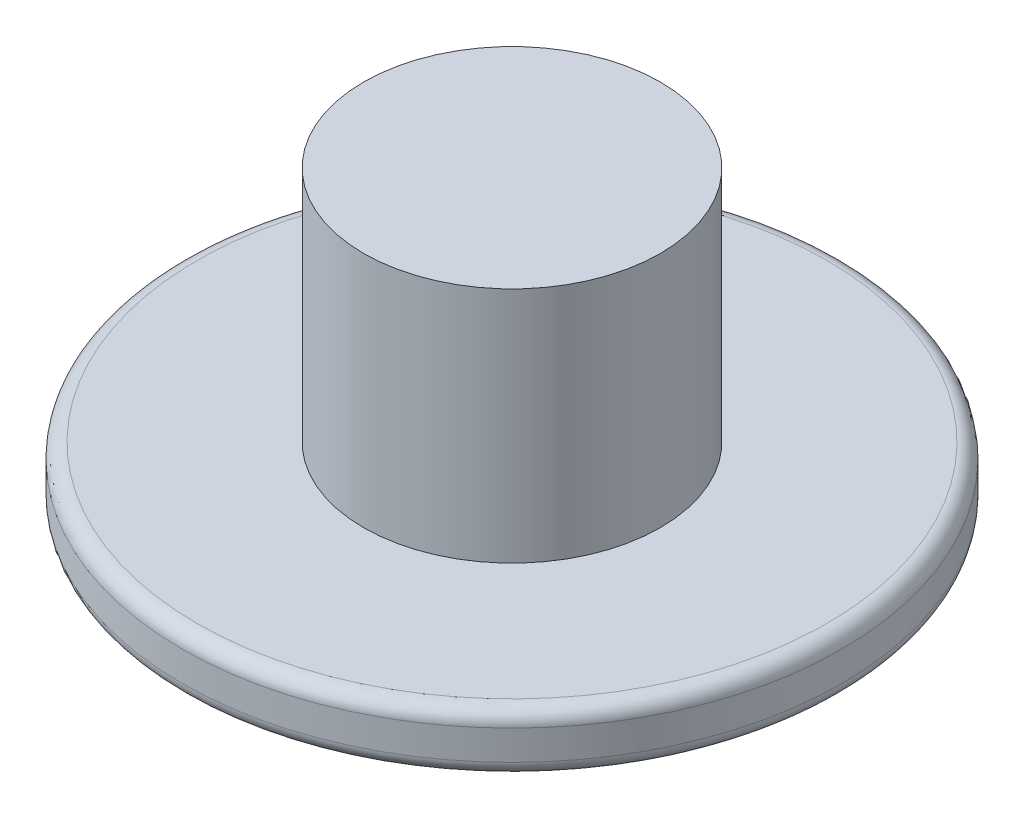
from build123d import *

# Parameters (mm, degrees)
SKETCH1_R           = 11.1
BOSS_EXTRUDE5_DEPTH = 2
SKETCH4_R           = 5
BOSS_EXTRUDE6_DEPTH = 8
CUT_EXTRUDE2_DEPTH  = 0.5
FILLET1_R           = 0.5


with BuildPart() as part:
    # Sketch1 → Boss-Extrude5 (new body)
    with BuildSketch(Plane(origin=(0, 0, 0), x_dir=(1, 0, 0), z_dir=(0, 1, 0))):
        with Locations(Location((-5.408676197, -40.3067379, 0), (0, 0, 270))):
            Circle(SKETCH1_R)
    extrude(amount=BOSS_EXTRUDE5_DEPTH)

    # Sketch4 → Boss-Extrude6 (add)
    with BuildSketch(Plane(origin=(0, 2, 0), x_dir=(1, 0, 0), z_dir=(0, 1, 0))):
        with Locations(Location((-5.408676197, -40.3067379, 0), (0, 0, 270))):
            Circle(SKETCH4_R)
    extrude(amount=BOSS_EXTRUDE6_DEPTH)

    # Sketch5 → Cut-Extrude2 (cut)
    # profile 1 of 2: a face of its own
    with BuildSketch(Plane.XZ):
        with BuildLine():
            add(Edge.make_bspline(
                [(-9.348280875, 34.997857225), (-9.429333066, 34.998925916), (-9.589055323, 35.00103189), (-9.824692592, 35.018969249), (-10.052139059, 35.047110023), (-10.271335187, 35.088929086), (-10.483398362, 35.137209285), (-10.686131565, 35.201546946), (-10.880525189, 35.277405617), (-11.066655927, 35.363831554), (-11.246416013, 35.46076718), (-11.41652077, 35.570711045), (-11.580603029, 35.689859604), (-11.731988802, 35.825058841), (-11.879672284, 35.966553737), (-12.017145665, 36.122411024), (-12.145997671, 36.289810874), (-12.225095718, 36.408144712), (-12.264947542, 36.467764632)],
                knots=[0, 0, 0, 0, 1.136959265, 2.24050327, 3.313538964, 4.350357384, 5.370001804, 6.362877957, 7.331147751, 8.295754707, 9.240328319, 10.193734322, 11.135547026, 12.081756115, 13.038655239, 14.003557421, 14.994136006, 16, 16, 16, 16], degree=3))
            add(Edge.make_bspline(
                [(-12.264947542, 36.467764632), (-12.289942987, 36.509599058), (-12.337758837, 36.589627584), (-12.387888727, 36.715200928), (-12.421628744, 36.837638128), (-12.425225681, 36.91958893), (-12.426984579, 36.959662781)],
                knots=[0, 0, 0, 0, 1.112928258, 2.129012325, 3.085089127, 4, 4, 4, 4], degree=3))
            add(Edge.make_bspline(
                [(-12.426984579, 36.959662781), (-12.42386445, 37.018611418), (-12.417733767, 37.134438536), (-12.362442051, 37.299905999), (-12.276027178, 37.451975969), (-12.156375821, 37.584975855), (-12.015845512, 37.694688532), (-11.862877809, 37.778848381), (-11.698339271, 37.828938976), (-11.584977892, 37.834547593), (-11.528064826, 37.837363398)],
                knots=[0, 0, 0, 0, 1.015359854, 1.995062352, 2.979785778, 4.01807891, 5.06205617, 6.045714794, 7.018851354, 8, 8, 8, 8], degree=3))
            add(Edge.make_bspline(
                [(-11.528064826, 37.837363398), (-11.469724299, 37.83435616), (-11.354883604, 37.828436549), (-11.190613761, 37.771014425), (-11.040274475, 37.678797497), (-10.957333486, 37.593729857), (-10.9146389, 37.549940558)],
                knots=[0, 0, 0, 0, 0.99888911, 1.966268167, 2.953119069, 4, 4, 4, 4], degree=3))
            add(Edge.make_bspline(
                [(-10.9146389, 37.549940558), (-10.879886734, 37.510744606), (-10.814314669, 37.436787791), (-10.722620774, 37.332452329), (-10.641410463, 37.245050369), (-10.575336051, 37.170386468), (-10.521334251, 37.110571578), (-10.479440485, 37.065014272), (-10.450829972, 37.033824854), (-10.435629616, 37.018791208), (-10.430456801, 37.013675126)],
                knots=[0, 0, 0, 0, 1.739958547, 3.283037843, 4.613396854, 5.70242641, 6.594602764, 7.289956713, 7.758366037, 8, 8, 8, 8], degree=3))
            add(Edge.make_bspline(
                [(-10.430456801, 37.013675126), (-10.36313084, 36.969076812), (-10.223989573, 36.876906333), (-9.976334602, 36.78875878), (-9.695380015, 36.734202734), (-9.495824901, 36.728995132), (-9.390719147, 36.726252287)],
                knots=[0, 0, 0, 0, 0.880598761, 1.819916513, 2.851749203, 4, 4, 4, 4], degree=3))
            add(Edge.make_bspline(
                [(-9.390719147, 36.726252287), (-9.310196622, 36.728306183), (-9.152233822, 36.732335356), (-8.920476184, 36.769202199), (-8.698236007, 36.823768439), (-8.486493219, 36.903396451), (-8.285798841, 37.007269388), (-8.095200026, 37.132741273), (-7.91343265, 37.280115557), (-7.804542441, 37.393739296), (-7.74912964, 37.451560929)],
                knots=[0, 0, 0, 0, 1.043544114, 2.047143341, 3.036120758, 4.007218486, 4.973146945, 5.960717165, 6.962235672, 8, 8, 8, 8], degree=3))
            add(Edge.make_bspline(
                [(-7.74912964, 37.451560929), (-7.698290904, 37.510330921), (-7.597702696, 37.626611708), (-7.471302174, 37.817509614), (-7.361845015, 38.01513562), (-7.272902713, 38.222638341), (-7.203360707, 38.43968009), (-7.152851188, 38.666184883), (-7.123862212, 38.902060553), (-7.120198073, 39.062208211), (-7.118342603, 39.143304756)],
                knots=[0, 0, 0, 0, 1.008012047, 1.994426572, 2.965889163, 3.938248186, 4.920413956, 5.921034844, 6.947240987, 8, 8, 8, 8], degree=3))
            add(Edge.make_bspline(
                [(-7.118342603, 39.143304756), (-7.119787334, 39.220472046), (-7.122582689, 39.369780131), (-7.134532938, 39.586355176), (-7.161145421, 39.78755433), (-7.191575578, 39.97443922), (-7.236956686, 40.145696376), (-7.290724001, 40.302535454), (-7.353213551, 40.445376304), (-7.427705844, 40.572401071), (-7.510388514, 40.684923347), (-7.603549658, 40.783401173), (-7.709065861, 40.863369288), (-7.821271667, 40.933845528), (-7.947121271, 40.981758755), (-8.079991019, 41.022374136), (-8.224362585, 41.042361901), (-8.323288585, 41.045584005), (-8.37412964, 41.047239941)],
                knots=[0, 0, 0, 0, 1.432194387, 2.771099032, 4.021603008, 5.196571272, 6.281788198, 7.304329707, 8.271053509, 9.169388415, 10.030836102, 10.857799991, 11.674021384, 12.482268335, 13.306473372, 14.163613793, 15.05622575, 16, 16, 16, 16], degree=3))
            add(Edge.make_bspline(
                [(-8.37412964, 41.047239941), (-8.464905564, 41.045032724), (-8.64192559, 41.04072848), (-8.900708904, 41.006657661), (-9.146078932, 40.954168305), (-9.37814883, 40.875990149), (-9.595614091, 40.775578674), (-9.800583453, 40.655190455), (-9.991611912, 40.512132094), (-10.105053007, 40.399840955), (-10.162324085, 40.343150435)],
                knots=[0, 0, 0, 0, 1.101333317, 2.147684583, 3.162570299, 4.142282915, 5.113003141, 6.06458838, 7.022901616, 8, 8, 8, 8], degree=3))
            add(Edge.make_bspline(
                [(-10.162324085, 40.343150435), (-10.250884709, 40.245254747), (-10.428588173, 40.048819784), (-10.608392703, 39.854306146), (-10.698589517, 39.756730682)],
                knots=[0, 0, 0, 0, 0.996723672, 2, 2, 2, 2], degree=3))
            add(Edge.make_bspline(
                [(-10.698589517, 39.756730682), (-10.755584777, 39.708890623), (-10.865389296, 39.616724103), (-11.049582114, 39.518140008), (-11.238830154, 39.452681545), (-11.368721074, 39.445757245), (-11.433543221, 39.44230167)],
                knots=[0, 0, 0, 0, 1.089532957, 2.099045497, 3.051327429, 4, 4, 4, 4], degree=3))
            add(Edge.make_bspline(
                [(-11.433543221, 39.44230167), (-11.492438694, 39.444954676), (-11.607037817, 39.450116911), (-11.770837069, 39.499819384), (-11.922808496, 39.574438076), (-12.053033193, 39.683537066), (-12.164427634, 39.809282749), (-12.243334945, 39.951771884), (-12.296009952, 40.104836581), (-12.30098749, 40.211535749), (-12.303527789, 40.265989941)],
                knots=[0, 0, 0, 0, 1.060372781, 2.06327896, 3.065177024, 4.096694214, 5.108961053, 6.080822624, 7.020542948, 8, 8, 8, 8], degree=3))
            add(Edge.make_bspline(
                [(-12.303527789, 40.265989941), (-12.302994491, 40.282071075), (-12.301627459, 40.323292784), (-12.29527765, 40.397237076), (-12.285542172, 40.496252508), (-12.271600831, 40.620309745), (-12.255203379, 40.769690233), (-12.23022912, 40.94419509), (-12.206561946, 41.143788627), (-12.187955277, 41.285172876), (-12.178141986, 41.359739941)],
                knots=[0, 0, 0, 0, 0.350634574, 0.898802078, 1.616951692, 2.519207815, 3.619566083, 4.892003884, 6.360820583, 8, 8, 8, 8], degree=3))
            add(Edge.make_bspline(
                [(-12.178141986, 41.359739941), (-12.15872112, 41.50696991), (-12.121590232, 41.788459904), (-12.070600301, 42.190822789), (-12.030962412, 42.555023018), (-11.995475131, 42.880241117), (-11.968264179, 43.167682688), (-11.948818799, 43.416540125), (-11.93606844, 43.626841221), (-11.934059707, 43.754273987), (-11.933157418, 43.811514632)],
                knots=[0, 0, 0, 0, 1.445824804, 2.764282433, 3.948511196, 5.012461347, 5.949332829, 6.759315622, 7.442705535, 8, 8, 8, 8], degree=3))
            add(Edge.make_bspline(
                [(-11.933157418, 43.811514632), (-11.93491163, 43.83928385), (-11.938754528, 43.900117035), (-11.96434307, 43.996961328), (-12.003460606, 44.10769117), (-12.056614208, 44.226252287), (-12.109767811, 44.344813404), (-12.148885347, 44.455543246), (-12.174473888, 44.552387539), (-12.178316787, 44.613220723), (-12.180070998, 44.640989941)],
                knots=[0, 0, 0, 0, 0.765069692, 1.676015005, 2.746174507, 4, 5.253825493, 6.323984995, 7.234930308, 8, 8, 8, 8], degree=3))
            add(Edge.make_bspline(
                [(-12.180070998, 44.640989941), (-12.176021797, 44.69117155), (-12.168129422, 44.788981466), (-12.104028665, 44.925444685), (-11.996568485, 45.03919921), (-11.90341267, 45.091618458), (-11.854067912, 45.119385003)],
                knots=[0, 0, 0, 0, 0.981153879, 1.912385446, 2.894187808, 4, 4, 4, 4], degree=3))
            add(Edge.make_bspline(
                [(-11.854067912, 45.119385003), (-11.810079248, 45.138406483), (-11.720081752, 45.177323), (-11.575018006, 45.217344496), (-11.418875184, 45.2406366), (-11.311455698, 45.243364433), (-11.256074085, 45.244770805)],
                knots=[0, 0, 0, 0, 0.932741244, 1.90831837, 2.92160439, 4, 4, 4, 4], degree=3))
            add(Edge.make_bspline(
                [(-11.256074085, 45.244770805), (-11.232282933, 45.244770805), (-11.178913591, 45.244770805), (-11.090822027, 45.244770805), (-10.986012356, 45.244770805), (-10.870271616, 45.244770805), (-10.754530875, 45.244770805), (-10.649721204, 45.244770805), (-10.56162964, 45.244770805), (-10.508260299, 45.244770805), (-10.484469147, 45.244770805)],
                knots=[0, 0, 0, 0, 0.74, 1.66, 2.74, 4, 5.26, 6.34, 7.26, 8, 8, 8, 8], degree=3))
            Line((-10.484469147, 45.244770805), (-7.415410505, 45.244770805))
            add(Edge.make_bspline(
                [(-7.415410505, 45.244770805), (-7.390955919, 45.245788824), (-7.33094576, 45.248286984), (-7.224876842, 45.261339993), (-7.085975694, 45.280561208), (-6.92543763, 45.306472804), (-6.764291751, 45.332634665), (-6.624075781, 45.351671669), (-6.515439367, 45.364841668), (-6.45349799, 45.367233564), (-6.427756184, 45.368227595)],
                knots=[0, 0, 0, 0, 0.5896073, 1.446862712, 2.573177991, 3.969148823, 5.365119654, 6.506784141, 7.379444323, 8, 8, 8, 8], degree=3))
            add(Edge.make_bspline(
                [(-6.427756184, 45.368227595), (-6.372093047, 45.365446739), (-6.264639748, 45.360078514), (-6.111881684, 45.313105901), (-5.973455291, 45.23989348), (-5.857247966, 45.133070673), (-5.757015376, 45.009152286), (-5.687496551, 44.862335586), (-5.64320855, 44.699514346), (-5.639027008, 44.58471241), (-5.636861122, 44.5252492)],
                knots=[0, 0, 0, 0, 1.029924964, 1.988189005, 2.937957498, 3.909411138, 4.894599592, 5.87588343, 6.899785187, 8, 8, 8, 8], degree=3))
            add(Edge.make_bspline(
                [(-5.636861122, 44.5252492), (-5.638277874, 44.483991343), (-5.641046497, 44.403365061), (-5.664645086, 44.286263375), (-5.704057448, 44.177756219), (-5.755202642, 44.075178902), (-5.82763126, 43.984858973), (-5.909933779, 43.89788478), (-6.011977349, 43.823891318), (-6.127216643, 43.756179863), (-6.255937746, 43.693302824), (-6.40268397, 43.645168157), (-6.562701978, 43.600238659), (-6.737941259, 43.563679153), (-6.928880387, 43.537992121), (-7.134608845, 43.515805391), (-7.356140756, 43.505142377), (-7.508638376, 43.50364368), (-7.587092603, 43.502872657)],
                knots=[0, 0, 0, 0, 0.805244239, 1.573611751, 2.320330751, 3.056093804, 3.799532367, 4.572095564, 5.388329092, 6.249773062, 7.182157615, 8.178952529, 9.260497266, 10.427866396, 11.670989424, 13.021716959, 14.467786609, 16, 16, 16, 16], degree=3))
            add(Edge.make_bspline(
                [(-7.587092603, 43.502872657), (-7.644961093, 43.503540602), (-7.774850739, 43.505039849), (-7.940161818, 43.506467872), (-8.077031326, 43.512970871), (-8.164524093, 43.513816419), (-8.232653738, 43.516755779), (-8.271247272, 43.5164875), (-8.287324085, 43.516375744)],
                knots=[0, 0, 0, 0, 1.487347207, 3.338448998, 4.247928013, 5.008260374, 5.586873499, 6, 6, 6, 6], degree=3))
            Line((-8.287324085, 43.516375744), (-10.204762356, 43.516375744))
            add(Edge.make_bspline(
                [(-10.204762356, 43.516375744), (-10.206653997, 43.486152612), (-10.21072054, 43.421180613), (-10.218170989, 43.315639752), (-10.230562091, 43.194880647), (-10.243224526, 43.057765263), (-10.261569989, 42.905545905), (-10.280154935, 42.736920801), (-10.303811919, 42.55315777), (-10.31989443, 42.425201667), (-10.328219147, 42.358968336)],
                knots=[0, 0, 0, 0, 0.624278521, 1.342039105, 2.180917254, 3.126624057, 4.18058585, 5.341411487, 6.62384703, 8, 8, 8, 8], degree=3))
            add(Edge.make_bspline(
                [(-10.328219147, 42.358968336), (-10.256647672, 42.39279168), (-10.11237939, 42.460970178), (-9.885178382, 42.545392106), (-9.648026179, 42.616743632), (-9.400373299, 42.673887013), (-9.143657166, 42.720758744), (-8.876356327, 42.753134113), (-8.59884175, 42.77285388), (-8.410171383, 42.774698148), (-8.314330258, 42.775635003)],
                knots=[0, 0, 0, 0, 0.915367454, 1.845127417, 2.800508147, 3.778382277, 4.783624371, 5.817838469, 6.891501507, 8, 8, 8, 8], degree=3))
            add(Edge.make_bspline(
                [(-8.314330258, 42.775635003), (-8.188125065, 42.771726819), (-7.941597473, 42.764092622), (-7.58319557, 42.710587337), (-7.248479424, 42.617342002), (-6.937337858, 42.488261303), (-6.650748474, 42.319698197), (-6.386250958, 42.116388835), (-6.147136679, 41.873278277), (-6.010863253, 41.688788466), (-5.941645072, 41.595079447)],
                knots=[0, 0, 0, 0, 1.094932711, 2.138827415, 3.135105282, 4.10287208, 5.053046373, 6.011635225, 6.990037934, 8, 8, 8, 8], degree=3))
            add(Edge.make_bspline(
                [(-5.941645072, 41.595079447), (-5.887376377, 41.512414105), (-5.778312044, 41.34628075), (-5.641482451, 41.077781369), (-5.52691693, 40.793818876), (-5.428620277, 40.495429561), (-5.356433483, 40.180100388), (-5.305410225, 39.849333378), (-5.27066113, 39.503481123), (-5.2678991, 39.26749251), (-5.266490752, 39.147162781)],
                knots=[0, 0, 0, 0, 0.919716147, 1.848362634, 2.7984311, 3.767289499, 4.768803224, 5.804709504, 6.88062942, 8, 8, 8, 8], degree=3))
            add(Edge.make_bspline(
                [(-5.266490752, 39.147162781), (-5.269858422, 39.002339951), (-5.276464944, 38.718234028), (-5.327397399, 38.301782218), (-5.411519733, 37.904350285), (-5.532568439, 37.526387338), (-5.68364989, 37.165860088), (-5.873903797, 36.827007544), (-6.091879718, 36.503611143), (-6.265326811, 36.309029137), (-6.352524702, 36.211205991)],
                knots=[0, 0, 0, 0, 1.083138383, 2.124844756, 3.133372969, 4.117611956, 5.08964535, 6.052074486, 7.020710048, 8, 8, 8, 8], degree=3))
            add(Edge.make_bspline(
                [(-6.352524702, 36.211205991), (-6.448963012, 36.114567975), (-6.639959723, 35.923175747), (-6.95931671, 35.674536884), (-7.302596671, 35.4662282), (-7.667326899, 35.292759978), (-8.055678687, 35.15949815), (-8.466260526, 35.065679123), (-8.899792717, 35.008689949), (-9.196354894, 35.001526825), (-9.348280875, 34.997857225)],
                knots=[0, 0, 0, 0, 0.983535996, 1.947899545, 2.909060314, 3.873256734, 4.853981293, 5.862616727, 6.905038893, 8, 8, 8, 8], degree=3))
        make_face()
    # profile 2 of 2: a face of its own
    with BuildSketch(Plane.XZ):
        with BuildLine():
            add(Edge.make_bspline(
                [(-0.941645072, 35.121314015), (-1.029772426, 35.12293994), (-1.203068832, 35.12613721), (-1.458320943, 35.147062274), (-1.70419682, 35.184487275), (-1.941134227, 35.233354761), (-2.168646034, 35.299627905), (-2.386737253, 35.381219561), (-2.59679109, 35.474784246), (-2.797123729, 35.584128528), (-2.988345765, 35.706627134), (-3.167939529, 35.847408217), (-3.340613513, 36.000067238), (-3.504239082, 36.167254283), (-3.657351889, 36.350480534), (-3.801568116, 36.547012218), (-3.937910955, 36.757781444), (-4.018152821, 36.906988798), (-4.058929023, 36.982810929)],
                knots=[0, 0, 0, 0, 1.101036621, 2.165113118, 3.196701619, 4.206636599, 5.185419256, 6.153861669, 7.113904655, 8.055726016, 9.002740657, 9.947572133, 10.903573382, 11.880673289, 12.867074579, 13.884141148, 14.924792093, 16, 16, 16, 16], degree=3))
            add(Edge.make_bspline(
                [(-4.058929023, 36.982810929), (-4.116837937, 37.100897487), (-4.234721535, 37.341283078), (-4.377577554, 37.72538705), (-4.499264216, 38.134114867), (-4.598178469, 38.567335011), (-4.678150882, 39.024971924), (-4.73297271, 39.507423487), (-4.765898873, 40.01539843), (-4.770374084, 40.362389784), (-4.772663591, 40.539909694)],
                knots=[0, 0, 0, 0, 0.86163265, 1.754002121, 2.682094637, 3.655395029, 4.66495959, 5.72569639, 6.83647195, 8, 8, 8, 8], degree=3))
            add(Edge.make_bspline(
                [(-4.772663591, 40.539909694), (-4.769643658, 40.693052534), (-4.763692401, 40.994844736), (-4.718261028, 41.439620506), (-4.644812477, 41.870130957), (-4.543564338, 42.287191676), (-4.409808122, 42.689437844), (-4.246725513, 43.076670336), (-4.056618939, 43.451013317), (-3.906553259, 43.687264006), (-3.831305566, 43.805727595)],
                knots=[0, 0, 0, 0, 1.065446396, 2.099630748, 3.107335507, 4.102416534, 5.082906438, 6.053454268, 7.02394022, 8, 8, 8, 8], degree=3))
            add(Edge.make_bspline(
                [(-3.831305566, 43.805727595), (-3.783788367, 43.874399046), (-3.690149735, 44.009724797), (-3.539190191, 44.201370962), (-3.380994429, 44.378812609), (-3.216221202, 44.543102553), (-3.046681749, 44.696399528), (-2.869681221, 44.835406891), (-2.684046546, 44.958989316), (-2.495105391, 45.072902364), (-2.298449368, 45.17221869), (-2.094940041, 45.256555348), (-1.88555679, 45.330904086), (-1.668297391, 45.387407231), (-1.445810599, 45.435038676), (-1.216214071, 45.466270511), (-0.980700592, 45.489547541), (-0.82146362, 45.490967246), (-0.741027789, 45.491684386)],
                knots=[0, 0, 0, 0, 1.089001194, 2.146014127, 3.179577203, 4.187716666, 5.179502559, 6.159265929, 7.119926927, 8.086463806, 9.035375073, 9.990160863, 10.958261042, 11.930674461, 12.915914311, 13.924053774, 14.951371286, 16, 16, 16, 16], degree=3))
            add(Edge.make_bspline(
                [(-0.741027789, 45.491684386), (-0.590258945, 45.487637024), (-0.295304948, 45.479719039), (0.13334404, 45.406119692), (0.53608556, 45.289162209), (0.912010365, 45.123366863), (1.26284396, 44.911534157), (1.585863728, 44.650356614), (1.885284461, 44.343993904), (2.054468838, 44.109038487), (2.140916656, 43.988983768)],
                knots=[0, 0, 0, 0, 1.065421073, 2.084317927, 3.065587267, 4.024520138, 4.981370049, 5.954971245, 6.955055573, 8, 8, 8, 8], degree=3))
            add(Edge.make_bspline(
                [(2.140916656, 43.988983768), (2.210306436, 43.881423098), (2.349107027, 43.666269157), (2.524236152, 43.32227651), (2.672947427, 42.962930242), (2.794871251, 42.586908054), (2.889331892, 42.194104744), (2.956060338, 41.784675803), (2.997679355, 41.359316888), (3.0026099, 41.070484719), (3.005114187, 40.923783151)],
                knots=[0, 0, 0, 0, 0.949659157, 1.899606148, 2.860462492, 3.834038165, 4.83079677, 5.856383007, 6.911229405, 8, 8, 8, 8], degree=3))
            add(Edge.make_bspline(
                [(3.005114187, 40.923783151), (3.002338738, 40.689649457), (2.996957409, 40.235686737), (2.95033678, 39.577568443), (2.874390599, 38.964258066), (2.767628738, 38.396174539), (2.629272214, 37.87293347), (2.460735599, 37.394587101), (2.259755194, 36.961415103), (2.028790458, 36.572640319), (1.764408812, 36.230767604), (1.472000677, 35.931152001), (1.1442991, 35.680980021), (0.786842158, 35.474255817), (0.397494351, 35.316452333), (-0.02121529, 35.201955498), (-0.471335953, 35.134225983), (-0.781945621, 35.125698438), (-0.941645072, 35.121314015)],
                knots=[0, 0, 0, 0, 1.410768719, 2.735344897, 3.97339736, 5.133070797, 6.215826799, 7.231830758, 8.185260544, 9.089012029, 9.950857309, 10.783804673, 11.604540534, 12.427350082, 13.264917127, 14.128798245, 15.03792469, 16, 16, 16, 16], degree=3))
        make_face()
        with BuildLine():
            add(Edge.make_bspline(
                [(-0.789253097, 43.763289324), (-0.875042074, 43.760763584), (-1.044298064, 43.755780465), (-1.29074583, 43.703025065), (-1.524305935, 43.621882234), (-1.745637429, 43.509295821), (-1.950558848, 43.359667667), (-2.144804302, 43.181120468), (-2.325638153, 42.969308577), (-2.429412898, 42.809709438), (-2.482925937, 42.727409694)],
                knots=[0, 0, 0, 0, 0.987720428, 1.948707218, 2.891188167, 3.832764918, 4.799652197, 5.806957348, 6.869123932, 8, 8, 8, 8], degree=3))
            add(Edge.make_bspline(
                [(-2.482925937, 42.727409694), (-2.527894961, 42.651565932), (-2.617919106, 42.499733199), (-2.730569789, 42.259700006), (-2.827924823, 42.01181322), (-2.907000571, 41.75446918), (-2.968327232, 41.488174733), (-3.01341621, 41.21314219), (-3.037839698, 40.928727896), (-3.042104198, 40.736068407), (-3.044268529, 40.638289324)],
                knots=[0, 0, 0, 0, 0.965078813, 1.932005355, 2.899623887, 3.879614671, 4.877106227, 5.890011682, 6.929132817, 8, 8, 8, 8], degree=3))
            add(Edge.make_bspline(
                [(-3.044268529, 40.638289324), (-3.043958537, 40.510952516), (-3.043357085, 40.263891798), (-3.026456113, 39.905030088), (-3.004507733, 39.569126911), (-2.97204759, 39.25568298), (-2.929032662, 38.964383685), (-2.8810536, 38.694607739), (-2.818896872, 38.448201233), (-2.769189025, 38.29366462), (-2.745271616, 38.219307842)],
                knots=[0, 0, 0, 0, 1.24838878, 2.422141985, 3.521760686, 4.548725799, 5.510782421, 6.408528782, 7.23424831, 8, 8, 8, 8], degree=3))
            add(Edge.make_bspline(
                [(-2.745271616, 38.219307842), (-2.703535188, 38.111393785), (-2.623124374, 37.903482911), (-2.464438905, 37.621683717), (-2.280513711, 37.382931489), (-2.070363668, 37.18722934), (-1.834458158, 37.035378081), (-1.57314407, 36.925231162), (-1.286154888, 36.861160361), (-1.086644623, 36.853597091), (-0.984083344, 36.849709077)],
                knots=[0, 0, 0, 0, 1.155090394, 2.225436224, 3.218966621, 4.155622191, 5.080634948, 6.007876656, 6.975918764, 8, 8, 8, 8], degree=3))
            add(Edge.make_bspline(
                [(-0.984083344, 36.849709077), (-0.897731001, 36.85270374), (-0.728986695, 36.858555722), (-0.484104479, 36.903358498), (-0.255804755, 36.978611369), (-0.045490329, 37.085992372), (0.147378971, 37.223147156), (0.324831719, 37.38840752), (0.483288274, 37.586238508), (0.626461462, 37.813237058), (0.751140059, 38.071188934), (0.858244197, 38.35836473), (0.951449408, 38.674648244), (1.025072277, 39.021121429), (1.082477609, 39.39799459), (1.124372686, 39.804169589), (1.149590687, 40.240590254), (1.152013127, 40.541160878), (1.153262335, 40.696159694)],
                knots=[0, 0, 0, 0, 0.839850773, 1.641183446, 2.412778331, 3.171043049, 3.929617431, 4.708684097, 5.522617875, 6.388740024, 7.314899046, 8.304914321, 9.368005926, 10.520288666, 11.748457435, 13.075714715, 14.491999149, 16, 16, 16, 16], degree=3))
            add(Edge.make_bspline(
                [(1.153262335, 40.696159694), (1.15196684, 40.820308093), (1.149460689, 41.060474667), (1.124999965, 41.408581069), (1.090690898, 41.73359831), (1.03561122, 42.034060722), (0.970374608, 42.311617678), (0.884145503, 42.563154171), (0.787224458, 42.792125267), (0.672823473, 42.996687593), (0.542888361, 43.176740004), (0.400174231, 43.336149121), (0.238023733, 43.467012601), (0.062962343, 43.577835492), (-0.12971826, 43.659783002), (-0.336225864, 43.719826253), (-0.557677741, 43.757654904), (-0.710650978, 43.761376869), (-0.789253097, 43.763289324)],
                knots=[0, 0, 0, 0, 1.451310721, 2.807578068, 4.078675786, 5.270246053, 6.377072111, 7.408892681, 8.375345316, 9.280835355, 10.142571817, 10.967410406, 11.774095613, 12.57101741, 13.382488036, 14.212790549, 15.081679558, 16, 16, 16, 16], degree=3))
        make_face(mode=Mode.SUBTRACT)
    extrude(amount=-CUT_EXTRUDE2_DEPTH, mode=Mode.SUBTRACT)

    # Fillet1
    fillet1_edges = [part.edges().sort_by_distance(p)[0] for p in [
        (-5.408676197, 0, 29.2067379),
        (-5.408676197, 2, 29.2067379),
    ]]
    fillet(fillet1_edges, radius=FILLET1_R)


solid = part.part
